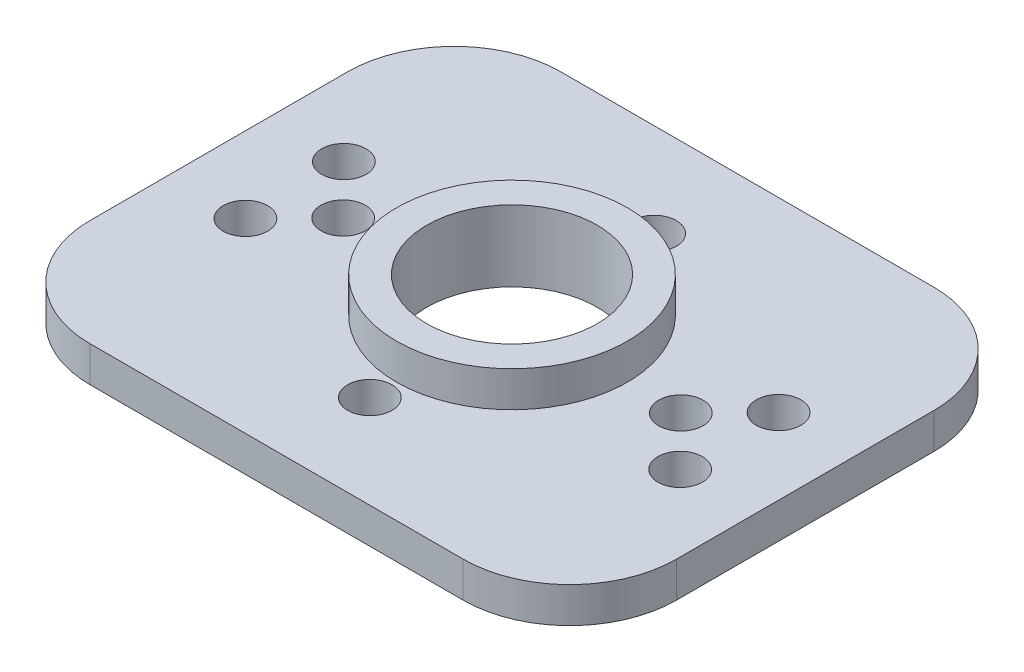
from build123d import *

# Parameters (mm, degrees)
SKETCH_1_R          = 1.25
SKETCH_1_R_2        = 4.8
EXTRUDE_1_DEPTH     = 2
SKETCH_3_R          = 6.5
SKETCH_3_R_2        = 4.8
EXTRUDE_2_DEPTH     = 2
SKETCH_5_R          = 1.25
CUT_EXTRUDE_1_DEPTH = 10


with BuildPart() as part:
    # 草图1 → 凸台-拉伸1 (new body)
    with BuildSketch(Plane(origin=(0, 0, 0), x_dir=(1, 0, 0), z_dir=(0, 1, 0))):
        with BuildLine():
            Line((10.5, -13.247031622), (-10.5, -13.247031622))
            ThreePointArc((-10.5, -13.247031622), (-14.742640687, -11.489672309), (-16.5, -7.247031622))
            Line((-16.5, -7.247031622), (-16.5, 7.247031622))
            ThreePointArc((-16.5, 7.247031622), (-14.742640687, 11.489672309), (-10.5, 13.247031622))
            Line((-10.5, 13.247031622), (10.5, 13.247031622))
            ThreePointArc((10.5, 13.247031622), (14.742640687, 11.489672309), (16.5, 7.247031622))
            Line((16.5, 7.247031622), (16.5, -7.247031622))
            ThreePointArc((16.5, -7.247031622), (14.742640687, -11.489672309), (10.5, -13.247031622))
        make_face()
        with Locations(Location((0, 8, 0), (0, 0, 270))):
            Circle(SKETCH_1_R, mode=Mode.SUBTRACT)
        with Locations(Location((0, -8, 0), (0, 0, 270))):
            Circle(SKETCH_1_R, mode=Mode.SUBTRACT)
        with Locations(Location((-9.5, 0, 0), (0, 0, 270))):
            Circle(SKETCH_1_R, mode=Mode.SUBTRACT)
        with Locations(Location((9.5, 0, 0), (0, 0, 270))):
            Circle(SKETCH_1_R, mode=Mode.SUBTRACT)
        with Locations(Location((0, 0, 0), (0, 0, 270))):
            Circle(SKETCH_1_R_2, mode=Mode.SUBTRACT)
    extrude(amount=EXTRUDE_1_DEPTH)

    # 草图3 → 凸台-拉伸2 (add)
    with BuildSketch(Plane(origin=(0, 2, 0), x_dir=(1, 0, 0), z_dir=(0, 1, 0))):
        with Locations(Location((0, 0, 0), (0, 0, 90))):
            Circle(SKETCH_3_R)
        with Locations(Location((0, 0, 0), (0, 0, 270))):
            Circle(SKETCH_3_R_2, mode=Mode.SUBTRACT)
    extrude(amount=EXTRUDE_2_DEPTH)

    # 草图5 → 切除-拉伸1 (cut)
    with BuildSketch(Plane(origin=(0, 2, 0), x_dir=(1, 0, 0), z_dir=(0, 1, 0))):
        with Locations(Location((-12.23, 2.77, 0), (0, 0, 270))):
            Circle(SKETCH_5_R)
        with Locations(Location((-12.23, -2.77, 0), (0, 0, 270))):
            Circle(SKETCH_5_R)
        with Locations(Location((12.23, -2.77, 0), (0, 0, 270))):
            Circle(SKETCH_5_R)
        with Locations(Location((12.23, 2.77, 0), (0, 0, 270))):
            Circle(SKETCH_5_R)
    extrude(amount=-CUT_EXTRUDE_1_DEPTH, mode=Mode.SUBTRACT)


solid = part.part
